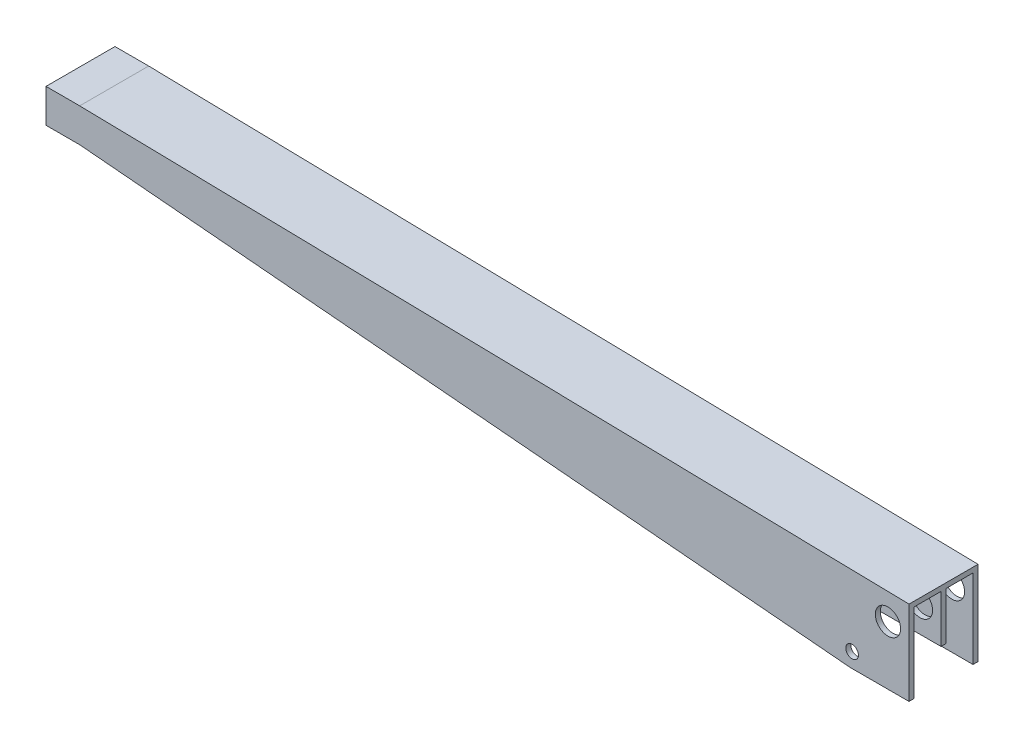
from build123d import *

# Parameters (mm, degrees)
BOSS_EXTRUDE1_DEPTH      = 15
BOSS_EXTRUDE2_DEPTH      = 15
BOSS_EXTRUDE3_DEPTH      = 192.8
BOSS_EXTRUDE4_DEPTH      = 7.5
BOSS_EXTRUDE4_DEPTH_BACK = 7.5
SKETCH5_R                = 38.1
SKETCH5_R_2              = 19.05
CUT_EXTRUDE1_DEPTH       = 2627.039580814
CUT_EXTRUDE2_DEPTH       = 15


with BuildPart() as part:
    # Sketch1 → Boss-Extrude1 (new body)
    with BuildSketch(Plane.XY):
        Polygon((-2600, 304.8), (-2498.4, 304.8), (0, 254), (0, 0), (-177.8, 0), (-2498.4, 203.2), (-2600, 203.2), align=None)
    extrude(amount=-BOSS_EXTRUDE1_DEPTH)



with BuildPart() as body_2:
    # Sketch2 → Boss-Extrude2 (new body)
    with BuildSketch(Plane.XY.offset(177.8)):
        Polygon((-2498.4, 203.2), (-177.8, 0), (0, 0), (0, 254), (-2498.4, 304.8), (-2600, 304.8), (-2600, 203.2), align=None)
    extrude(amount=BOSS_EXTRUDE2_DEPTH)


with BuildPart() as part_1:
    add(part.part)

    add(body_2.part)  # Boss-Extrude3 merges body 2
    # Sketch3 → Boss-Extrude3 (add)
    with BuildSketch(Plane.XY.offset(192.8)):
        Polygon((-2600, 289.8), (-2600, 304.8), (-2498.4, 304.8), (0, 254), (0, 238.996899585), (-15, 239.301894782), (-2498.55248184, 289.8), align=None)
    extrude(amount=-BOSS_EXTRUDE3_DEPTH)

    # Sketch6 → Boss-Extrude4 (add, two sides: drawn at the far end of the back side and taken through both)
    with BuildSketch(Plane.XY.offset(88.9).offset(-BOSS_EXTRUDE4_DEPTH_BACK)):
        Polygon((-2498.4, 203.2), (-177.8, 0), (0, 0), (0, 254), (-2498.4, 304.8), (-2600, 304.8), (-2600, 203.2), align=None)
    extrude(amount=BOSS_EXTRUDE4_DEPTH + BOSS_EXTRUDE4_DEPTH_BACK)

    # Sketch5 → Cut-Extrude1 (cut, through all)
    with BuildSketch(Plane.XY.offset(192.8)):
        with Locations((-63.5, 176.782795882)):
            Circle(SKETCH5_R)
        with Locations((-171.45, 44.45)):
            Circle(SKETCH5_R_2)
    extrude(amount=-CUT_EXTRUDE1_DEPTH, mode=Mode.SUBTRACT)

    # Sketch7 → Cut-Extrude2 (cut)
    with BuildSketch(Plane.XY.offset(96.4)):
        Polygon((-1265.58125, 95.25), (0, 95.25), (0, 0), (-177.8, 0), align=None)
    extrude(amount=-CUT_EXTRUDE2_DEPTH, mode=Mode.SUBTRACT)


solid = part_1.part
